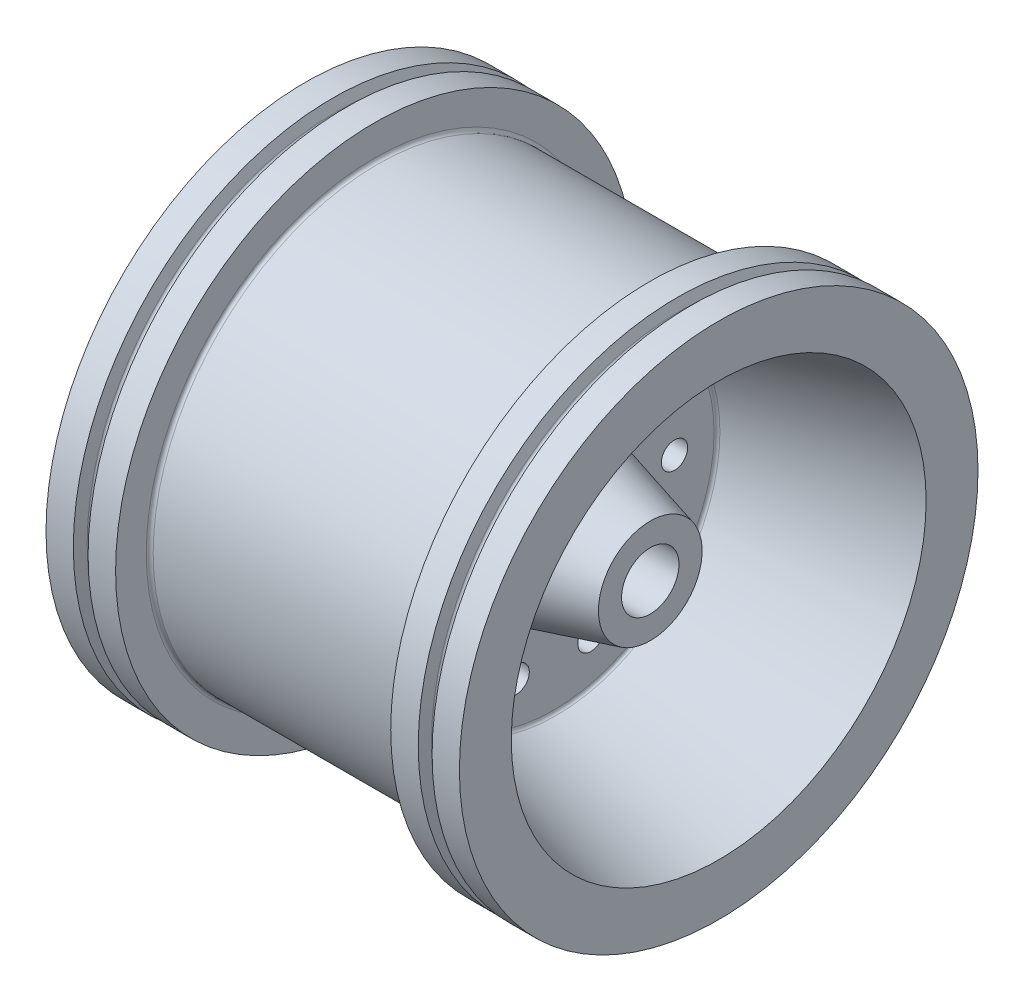
from build123d import *

# Parameters (mm, degrees)
F_3_8_0_3_DIAMETER_HOLE1_D = 7.62
CIRPATTERN1_COUNT          = 10
SKETCH4_R                  = 10.75
CUT_EXTRUDE1_DEPTH         = 6.9
FILLET1_R                  = 1
FILLET2_R                  = 1
FILLET3_R                  = 1


with BuildPart() as part:
    # Sketch1 → Revolve1 (revolve)
    with BuildSketch(Plane.XY, mode=Mode.PRIVATE) as revolve1_sk:
        Polygon((-12, 65), (12, 65), (39.791303716, 65), (39.791303716, 74.869572123), (47.7504652, 74.869572123), (49.791303716, 69.942996854), (51.885793908, 75), (59.791303716, 75), (59.791303716, 60), (12.009618943, 47.196936152), (12.009618943, 22.5), (40, 15), (40, 8.308612067), (-40, 8.308612067), (-40, 15), (-12.009618943, 22.5), (-12.009618943, 47.196936152), (-59.791303716, 60), (-59.791303716, 75), (-51.885793908, 75), (-49.791303716, 69.942996854), (-47.7504652, 74.869572123), (-39.791303716, 74.869572123), (-39.791303716, 65), align=None)
    revolve(revolve1_sk.sketch.rotate(Axis((-439.542794811, 0, 0), (1, 0, 0)), 90), axis=Axis((-439.542794811, 0, 0), (1, 0, 0)))

    # 3/8 (0.3) Diameter Hole1 (through all)
    with Locations(Plane(origin=(12.009618943, 0, 0), x_dir=(0, 0, -1), z_dir=(1, 0, 0))):
        with Locations((35, 0)):
            f_3_8_0_3_diameter_hole1 = Hole(F_3_8_0_3_DIAMETER_HOLE1_D / 2)

    # CirPattern1: 3/8 (0.3) Diameter Hole1 ×10 about axis
    cirpattern1_axis = Axis((0, 0, 0), (1, 0, 0))
    for i in range(1, CIRPATTERN1_COUNT):
        add(f_3_8_0_3_diameter_hole1.rotate(cirpattern1_axis, i * 360 / CIRPATTERN1_COUNT), mode=Mode.SUBTRACT)

    # Sketch4 → Cut-Extrude1 (cut)
    with BuildSketch(Plane.ZY.offset(40)):
        Circle(SKETCH4_R)
    extrude(amount=-CUT_EXTRUDE1_DEPTH, mode=Mode.SUBTRACT)

    # Fillet1
    fillet1_edges = [part.edges().sort_by_distance(p)[0] for p in [
        (-33.1, 0, -10.75),
        (-12.009618943, 0, -22.5),
        (-12.009618943, 0, -47.196936152),
    ]]
    fillet(fillet1_edges, radius=FILLET1_R)

    # Fillet2
    fillet2_edges = [part.edges().sort_by_distance(p)[0] for p in [
        (39.791303716, 0, -65),
        (49.791303716, 0, -69.942996854),
        (-49.791303716, 0, -69.942996854),
        (-39.791303716, 0, -65),
    ]]
    fillet(fillet2_edges, radius=FILLET2_R)

    # Fillet3
    fillet3_edges = [part.edges().sort_by_distance(p)[0] for p in [
        (12.009618943, 0, -47.196936152),
        (12.009618943, 0, -22.5),
    ]]
    fillet(fillet3_edges, radius=FILLET3_R)


solid = part.part
